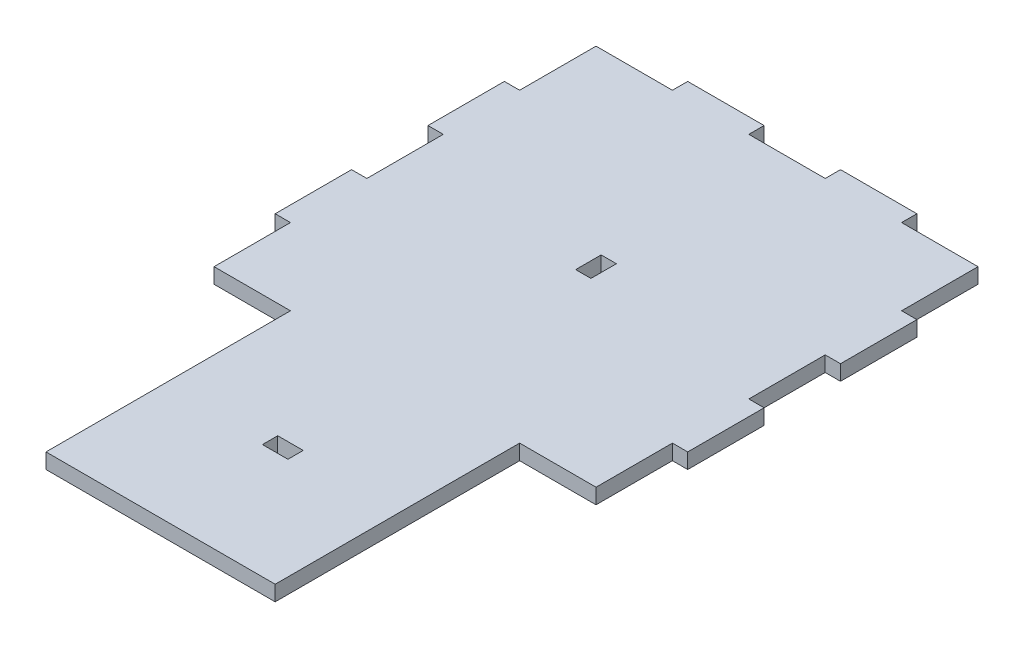
from build123d import *

# Parameters (mm, degrees)
ESBO_O1_W                  = 150
ESBO_O1_H                  = 150
RESSALTO_EXTRUS_O1_DEPTH   = 6
ESBO_O3_W                  = 30
ESBO_O3_H                  = 6
RESSALTO_EXTRUS_O3_DEPTH   = 6
ESBO_O6_W                  = 30
ESBO_O6_H                  = 6
RESSALTO_EXTRUS_O6_DEPTH   = 6
ESBO_O7_W                  = 30
ESBO_O7_H                  = 6
RESSALTO_EXTRUS_O8_DEPTH   = 6
ESBO_O9_W                  = 90
ESBO_O9_H                  = 6
RESSALTO_EXTRUS_O9_DEPTH   = 6
ESBO_O10_W                 = 90
ESBO_O10_H                 = 6
RESSALTO_EXTRUS_O10_DEPTH  = 90
ESBO_O11_W                 = 10
ESBO_O11_H                 = 6
CORTE_EXTRUS_O1_DEPTH      = 221.698889893
CORTE_EXTRUS_O2_DEPTH      = 221.698889893
CORTE_EXTRUS_O2_DEPTH_BACK = 221.698889893
ESBO_O12_W                 = 6
ESBO_O12_H                 = 10


with BuildPart() as part:
    # Esboço1 → Ressalto-extrusão1 (new body)
    with BuildSketch(Plane(origin=(0, 0, 0), x_dir=(1, 0, 0), z_dir=(0, 1, 0))):
        with Locations((75, 75)):
            Rectangle(ESBO_O1_W, ESBO_O1_H)
    extrude(amount=RESSALTO_EXTRUS_O1_DEPTH)

    # Esboço3 → Ressalto-extrusão3 (add)
    with BuildSketch(Plane(origin=(0, 0, -150), x_dir=(-1, 0, 0), z_dir=(0, 0, -1))):
        with Locations((-105, 3)):
            Rectangle(ESBO_O3_W, ESBO_O3_H)
        with Locations((-45, 3)):
            Rectangle(ESBO_O3_W, ESBO_O3_H)
    extrude(amount=RESSALTO_EXTRUS_O3_DEPTH)

    # Esboço6 → Ressalto-extrusão6 (add)
    with BuildSketch(Plane(origin=(150, 0, 0), x_dir=(0, 0, -1), z_dir=(1, 0, 0))):
        with Locations((45, 3)):
            Rectangle(ESBO_O6_W, ESBO_O6_H)
        with Locations((105, 3)):
            Rectangle(ESBO_O6_W, ESBO_O6_H)
    extrude(amount=RESSALTO_EXTRUS_O6_DEPTH)

    # Esboço7 → Ressalto-extrusão8 (add)
    with BuildSketch(Plane.ZY):
        with Locations((-105, 3)):
            Rectangle(ESBO_O7_W, ESBO_O7_H)
        with Locations((-45, 3)):
            Rectangle(ESBO_O7_W, ESBO_O7_H)
    extrude(amount=RESSALTO_EXTRUS_O8_DEPTH)

    # Esboço9 → Ressalto-extrusão9 (add)
    with BuildSketch(Plane.XY):
        with Locations((75, 3)):
            Rectangle(ESBO_O9_W, ESBO_O9_H)
    extrude(amount=RESSALTO_EXTRUS_O9_DEPTH)

    # Esboço10 → Ressalto-extrusão10 (add)
    with BuildSketch(Plane.XY.offset(6)):
        with Locations((75, 3)):
            Rectangle(ESBO_O10_W, ESBO_O10_H)
    extrude(amount=RESSALTO_EXTRUS_O10_DEPTH)

    # Esboço11 → Corte-extrusão1 (cut, through all)
    with BuildSketch(Plane(origin=(0, 6, 0), x_dir=(1, 0, 0), z_dir=(0, 1, 0))):
        with Locations((75, -48)):
            Rectangle(ESBO_O11_W, ESBO_O11_H)
    extrude(amount=-CORTE_EXTRUS_O1_DEPTH, mode=Mode.SUBTRACT)

    # Esboço12 → Corte-extrusão2 (cut, two sides: drawn at the far end of the back side and taken through both)
    with BuildSketch(Plane(origin=(0, 6, 0), x_dir=(1, 0, 0), z_dir=(0, 1, 0)).offset(-CORTE_EXTRUS_O2_DEPTH_BACK)):
        with Locations((75, 75)):
            Rectangle(ESBO_O12_W, ESBO_O12_H)
    extrude(amount=CORTE_EXTRUS_O2_DEPTH + CORTE_EXTRUS_O2_DEPTH_BACK, mode=Mode.SUBTRACT)


solid = part.part
